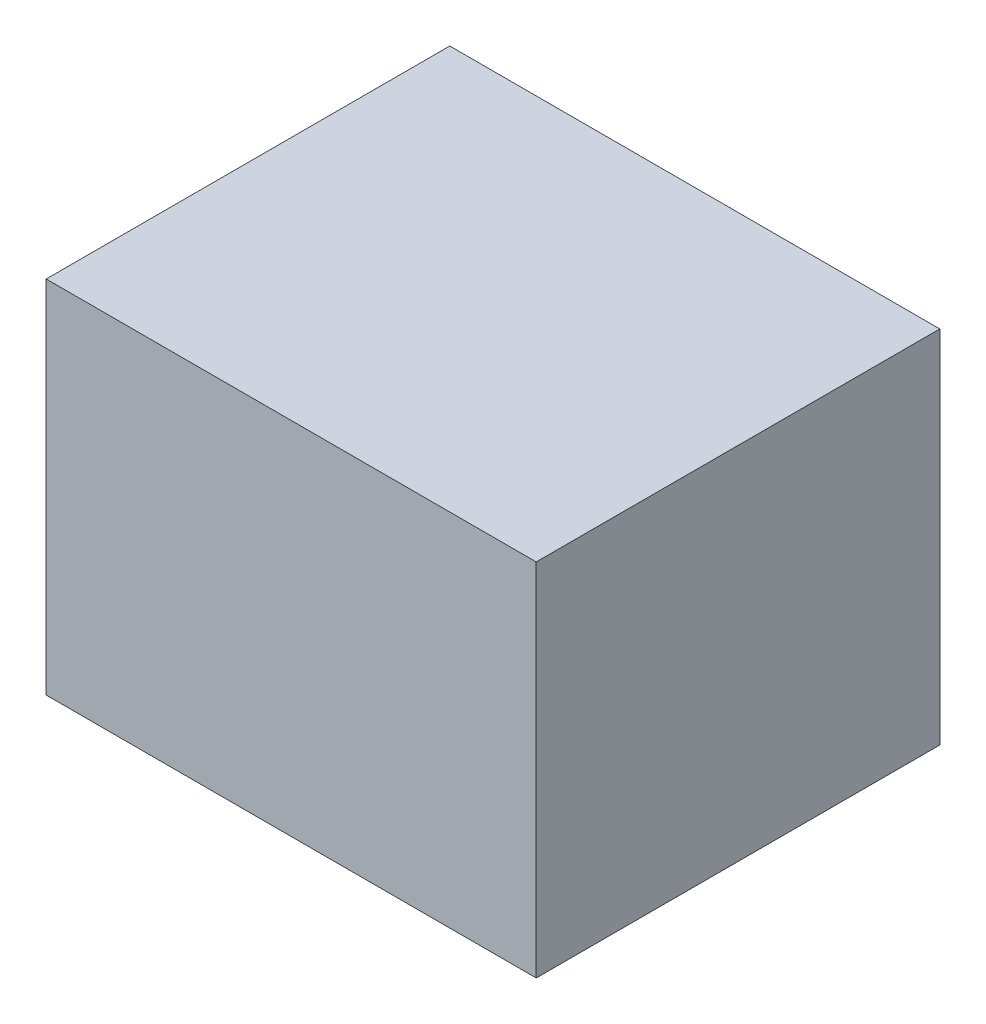
from build123d import *

# Parameters (mm, degrees)
SKETCH1_W           = 340
SKETCH1_H           = 280
BOSS_EXTRUDE1_DEPTH = 250


with BuildPart() as part:
    # Sketch1 → Boss-Extrude1 (new body)
    with BuildSketch(Plane(origin=(0, 0, 0), x_dir=(1, 0, 0), z_dir=(0, 1, 0))):
        Rectangle(SKETCH1_W, SKETCH1_H)
    extrude(amount=BOSS_EXTRUDE1_DEPTH)


solid = part.part
